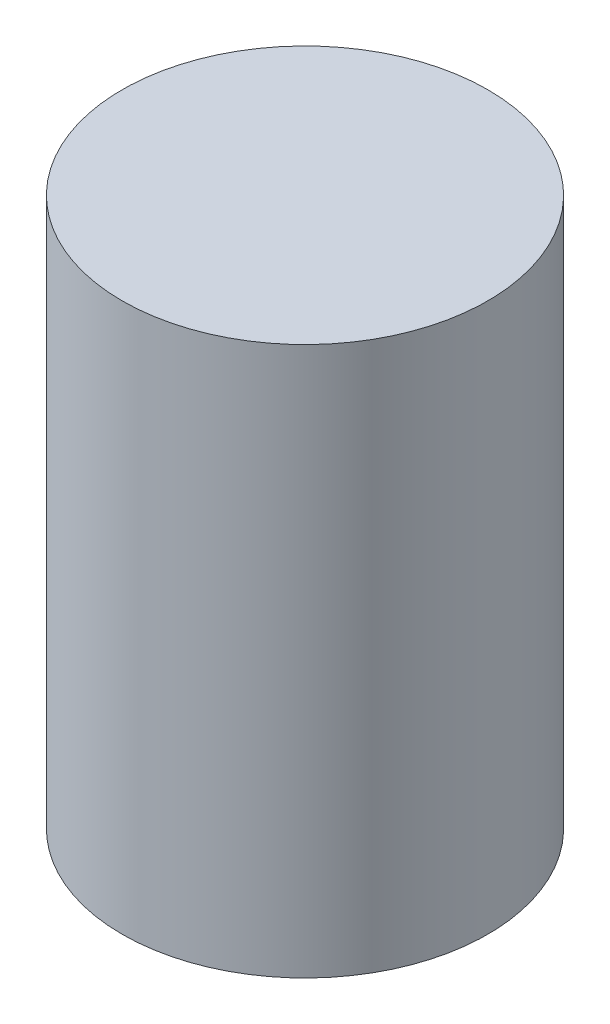
from build123d import *

# Parameters (mm, degrees)
SKETCH1_R           = 25.4
BOSS_EXTRUDE1_DEPTH = 76.2
SHELL1_T            = 6.35
CUT_EXTRUDE1_REACH  = 86.242
SKETCH2_R           = 9.525


with BuildPart() as part:
    # Sketch1 → Boss-Extrude1 (new body)
    with BuildSketch(Plane(origin=(0, 0, 0), x_dir=(1, 0, 0), z_dir=(0, 1, 0))):
        with Locations(Location((0, 0, 0), (0, 0, 90))):
            Circle(SKETCH1_R)
    extrude(amount=BOSS_EXTRUDE1_DEPTH)

    # Shell1 (no face opened: a closed hollow body)
    add(offset(amount=-SHELL1_T, mode=Mode.PRIVATE), mode=Mode.SUBTRACT)

    # Sketch2 → Cut-Extrude1 (cut, up to next)
    with BuildSketch(Plane.XZ, mode=Mode.PRIVATE) as cut_extrude1_sk1:
        with Locations(Location((0, 0, 0), (0, 0, 270))):
            Circle(SKETCH2_R)
    cut_extrude1_tool1 = extrude(cut_extrude1_sk1.sketch, amount=-CUT_EXTRUDE1_REACH, mode=Mode.PRIVATE) & part.part
    add(cut_extrude1_tool1.solids().sort_by_distance((0, 0, 0))[0], mode=Mode.SUBTRACT)


solid = part.part
